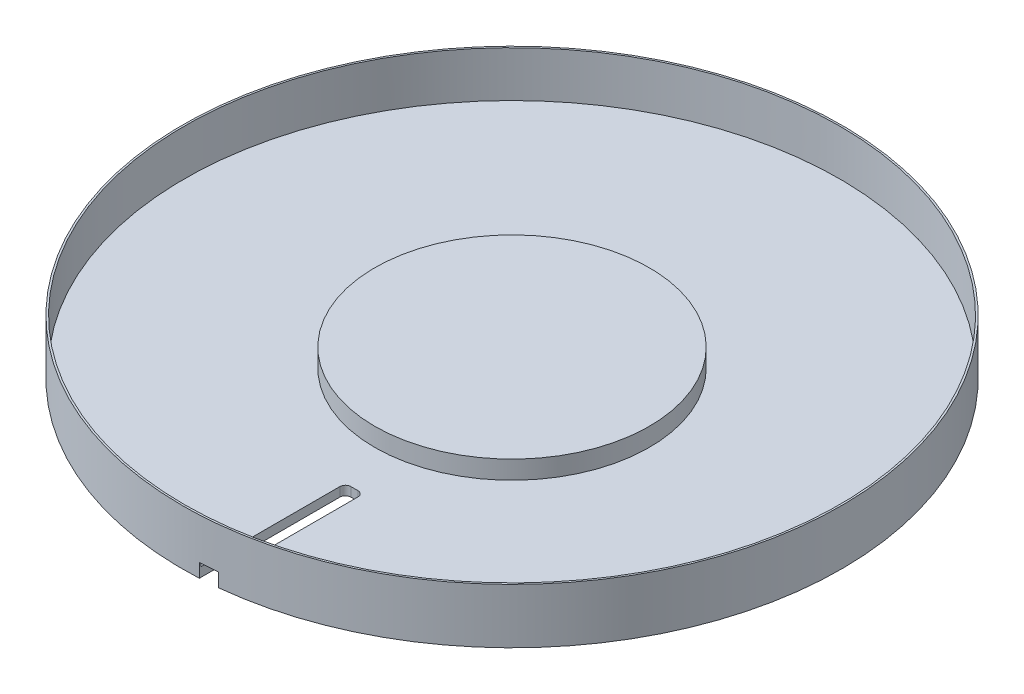
from build123d import *

# Parameters (mm, degrees)
SKETCH1_R           = 360
BOSS_EXTRUDE1_DEPTH = 60
SKETCH2_R           = 358
SKETCH2_R_2         = 150
CUT_EXTRUDE1_DEPTH  = 50
SKETCH3_W           = 19.673543
SKETCH3_H           = 15
CUT_EXTRUDE2_DEPTH  = 160
MOVE_FACE1_BY       = 30
FILLET1_R           = 6


with BuildPart() as part:
    # Sketch1 → Boss-Extrude1 (new body)
    with BuildSketch(Plane(origin=(0, 0, 0), x_dir=(1, 0, 0), z_dir=(0, 1, 0))):
        with Locations(Location((0, 0, 0), (0, 0, 270))):
            Circle(SKETCH1_R)
    extrude(amount=BOSS_EXTRUDE1_DEPTH)

    # Sketch2 → Cut-Extrude1 (cut)
    with BuildSketch(Plane(origin=(0, 60, 0), x_dir=(1, 0, 0), z_dir=(0, 1, 0))):
        with Locations(Location((0, 0, 0), (0, 0, 270))):
            Circle(SKETCH2_R)
        with Locations(Location((0, 0, 0), (0, 0, 270))):
            Circle(SKETCH2_R_2, mode=Mode.SUBTRACT)
    extrude(amount=-CUT_EXTRUDE1_DEPTH, mode=Mode.SUBTRACT)

    # Sketch3 → Cut-Extrude2 (cut)
    with BuildSketch(Plane.XY.offset(360)):
        with Locations((27.8367715, 7.5)):
            Rectangle(SKETCH3_W, SKETCH3_H)
    extrude(amount=-CUT_EXTRUDE2_DEPTH, mode=Mode.SUBTRACT)

    # Move Face1: a face moved inward by 30.0
    extrude(part.faces().sort_by_distance((0, 60, 0))[0], amount=MOVE_FACE1_BY, dir=(0, -1, 0), mode=Mode.SUBTRACT)

    # Fillet1
    fillet1_edges = [part.edges().sort_by_distance(p)[0] for p in [
        (18, 5, 200),
        (37.673543, 5, 200),
    ]]
    fillet(fillet1_edges, radius=FILLET1_R)


solid = part.part
